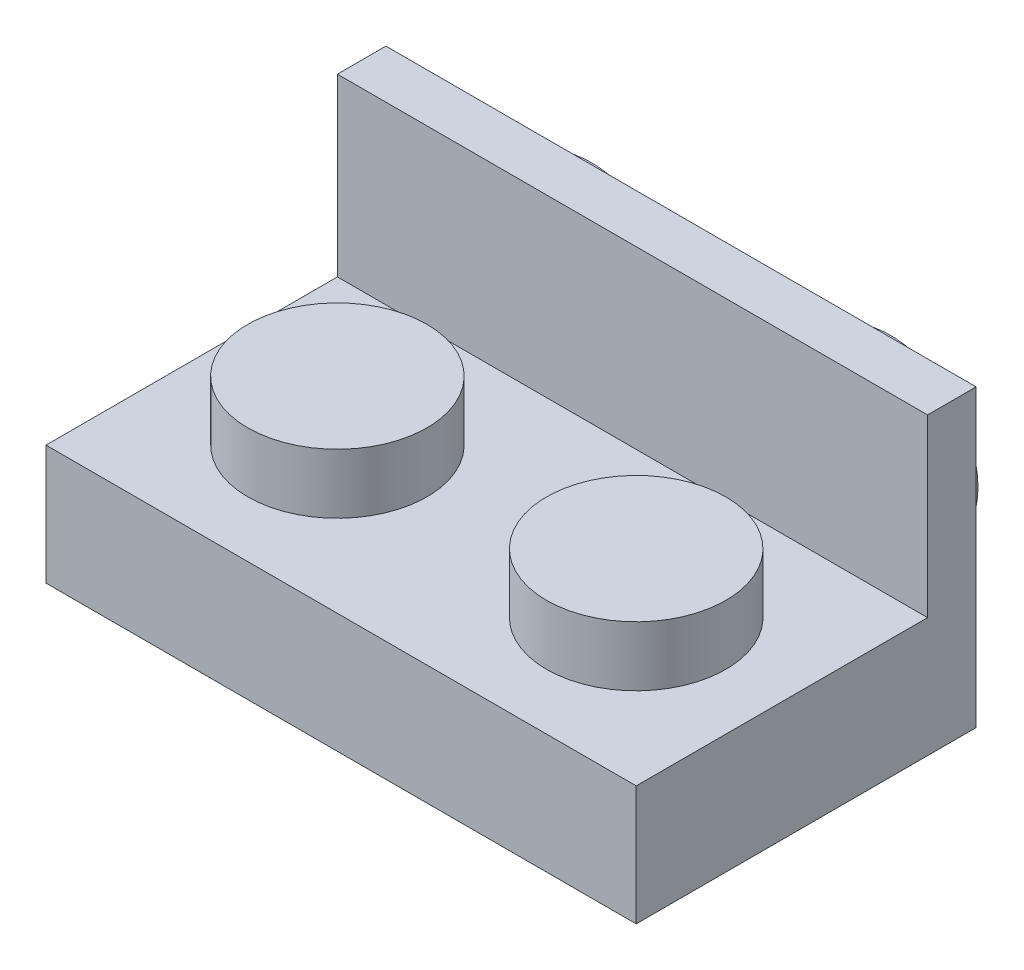
from build123d import *

# Parameters (mm, degrees)
SKETCH1_W            = 15.8
SKETCH1_H            = 3.2
BOSS_EXTRUDE1_DEPTH  = 7.8
SKETCH2_R            = 2.4
BOSS_EXTRUDE2_DEPTH  = 1.6
LPATTERN1_COUNT      = 2
LPATTERN1_PITCH      = 8
LPATTERN1_COUNT_DIR2 = 4
LPATTERN1_PITCH_DIR2 = 8
SHELL1_T             = -1.2
SKETCH3_R            = 1.5
SKETCH3_R_2          = 0.6
BOSS_EXTRUDE3_DEPTH  = 1.8
SKETCH4_W            = 15.8
SKETCH4_H            = 7.9
BOSS_EXTRUDE4_DEPTH  = 1.3
SKETCH5_R            = 2.35
SKETCH5_R_2          = 1.65
BOSS_EXTRUDE5_DEPTH  = 1.6
LPATTERN2_COUNT      = 2
LPATTERN2_PITCH      = 8


with BuildPart() as part:
    # Sketch1 → Boss-Extrude1 (new body)
    with BuildSketch(Plane.XY):
        with Locations((7.9, 1.6)):
            Rectangle(SKETCH1_W, SKETCH1_H)
    extrude(amount=-BOSS_EXTRUDE1_DEPTH)

    # Sketch2 → Boss-Extrude2 (add)
    with BuildSketch(Plane(origin=(0, 3.2, 0), x_dir=(1, 0, 0), z_dir=(0, 1, 0))):
        with Locations(Location((3.9, 3.9, 0), (0, 0, 270))):
            Circle(SKETCH2_R)
    boss_extrude2 = extrude(amount=BOSS_EXTRUDE2_DEPTH)

    # LPattern1: Boss-Extrude2 2 × 4, 6 skipped
    with Locations(*[(j * LPATTERN1_PITCH_DIR2, 0, i * LPATTERN1_PITCH) for i in range(LPATTERN1_COUNT) for j in range(LPATTERN1_COUNT_DIR2) if (i, j) not in ((0, 0), (0, 2), (0, 3), (1, 0), (1, 1), (1, 2), (1, 3))]):
        add(boss_extrude2)

    # Shell1
    shell1_openings = [part.faces().sort_by_distance(p)[0] for p in [
        (7.9, 0, -3.9),
    ]]
    offset(amount=SHELL1_T, openings=shell1_openings, kind=Kind.INTERSECTION)

    # Sketch3 → Boss-Extrude3 (add)
    with BuildSketch(Plane.XZ.offset(-2)):
        with Locations(Location((7.9, -3.9, 0), (0, 0, 90))):
            Circle(SKETCH3_R)
        with Locations(Location((7.9, -3.9, 0), (0, 0, 270))):
            Circle(SKETCH3_R_2, mode=Mode.SUBTRACT)
    extrude(amount=BOSS_EXTRUDE3_DEPTH)

    # Sketch4 → Boss-Extrude4 (add)
    with BuildSketch(Plane(origin=(0, 0, -7.8), x_dir=(-1, 0, 0), z_dir=(0, 0, -1))):
        with Locations((-7.9, 3.95)):
            Rectangle(SKETCH4_W, SKETCH4_H)
    extrude(amount=BOSS_EXTRUDE4_DEPTH)

    # Sketch5 → Boss-Extrude5 (add)
    with BuildSketch(Plane(origin=(0, 0, -9.1), x_dir=(-1, 0, 0), z_dir=(0, 0, -1))):
        with Locations(Location((-11.9, 4, 0), (0, 0, 180))):
            Circle(SKETCH5_R)
        with Locations((-11.9, 4)):
            Circle(SKETCH5_R_2, mode=Mode.SUBTRACT)
    boss_extrude5 = extrude(amount=BOSS_EXTRUDE5_DEPTH)

    # LPattern2: Boss-Extrude5 ×2
    with Locations(*[(-i * LPATTERN2_PITCH, 0, 0) for i in range(1, LPATTERN2_COUNT)]):
        add(boss_extrude5)


solid = part.part
